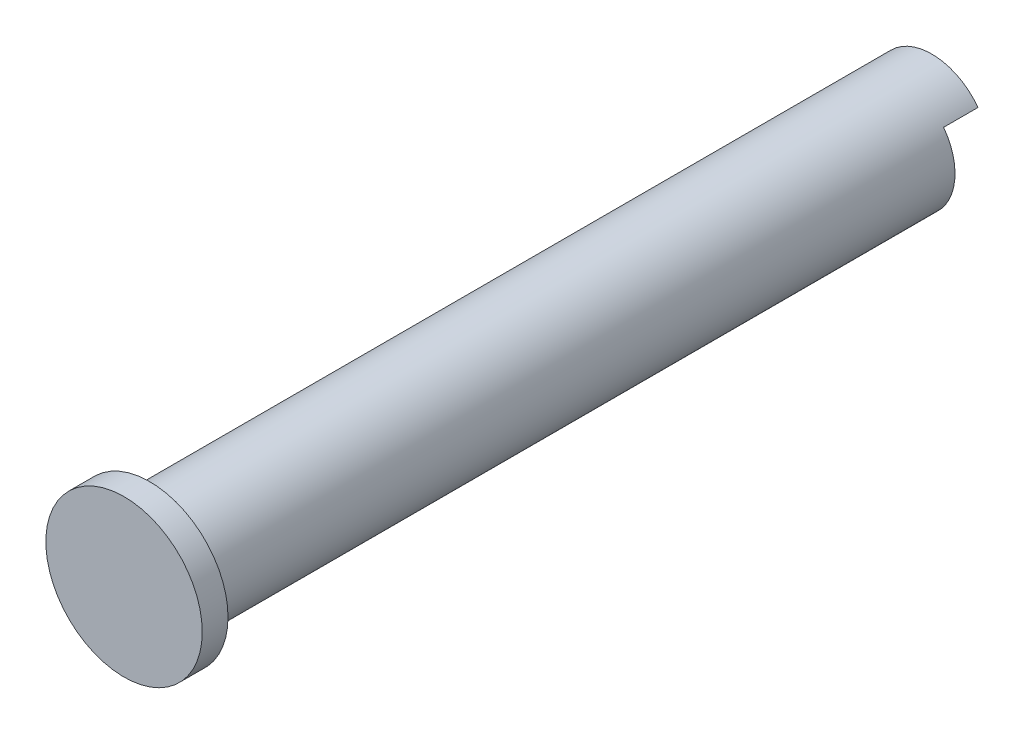
from build123d import *

# Parameters (mm, degrees)
ESBO_O1_R                                   = 9.1
RESSALTO_EXTRUS_O1_DEPTH                    = 3
ESBO_O2_R                                   = 6.7
RESSALTO_EXTRUS_O2_DEPTH                    = 87
FURO_ROSCADO_PARA_CONDU_TE_DE_M4X0_72_D     = 4.2
FURO_ROSCADO_PARA_CONDU_TE_DE_M4X0_72_DEPTH = 22
FURO_ROSCADO_PARA_CONDU_TE_DE_M4X0_72_TIP   = 1.2618073
RESSALTO_EXTRUS_O3_DEPTH                    = 4


with BuildPart() as part:
    # Esboço1 → Ressalto-extrusão1 (new body)
    with BuildSketch(Plane.XY):
        Circle(ESBO_O1_R)
    extrude(amount=-RESSALTO_EXTRUS_O1_DEPTH)

    # Esboço2 → Ressalto-extrusão2 (add)
    with BuildSketch(Plane(origin=(0, 0, -3), x_dir=(-1, 0, 0), z_dir=(0, 0, -1))):
        Circle(ESBO_O2_R)
    extrude(amount=RESSALTO_EXTRUS_O2_DEPTH)

    # Furo roscado para conduíte de M4x0.72
    with Locations(Plane(origin=(0, 0, -90), x_dir=(-1, 0, 0), z_dir=(0, 0, -1))):
        with Locations((0, 0)):
            Hole(FURO_ROSCADO_PARA_CONDU_TE_DE_M4X0_72_D / 2, depth=FURO_ROSCADO_PARA_CONDU_TE_DE_M4X0_72_DEPTH)
            with Locations((0, 0, -(FURO_ROSCADO_PARA_CONDU_TE_DE_M4X0_72_DEPTH + FURO_ROSCADO_PARA_CONDU_TE_DE_M4X0_72_TIP / 2))):  # 118° drill point
                Cone(0, FURO_ROSCADO_PARA_CONDU_TE_DE_M4X0_72_D / 2, FURO_ROSCADO_PARA_CONDU_TE_DE_M4X0_72_TIP, mode=Mode.SUBTRACT)

    # Esboço7 → Ressalto-extrusão3 (add)
    with BuildSketch(Plane(origin=(0, 0, -90), x_dir=(-1, 0, 0), z_dir=(0, 0, -1))):
        with BuildLine():
            Line((-5.37494186, 4), (5.37494186, 4))
            ThreePointArc((5.37494186, 4), (0, 6.7), (-5.37494186, 4))
        make_face()
    extrude(amount=RESSALTO_EXTRUS_O3_DEPTH)


solid = part.part
